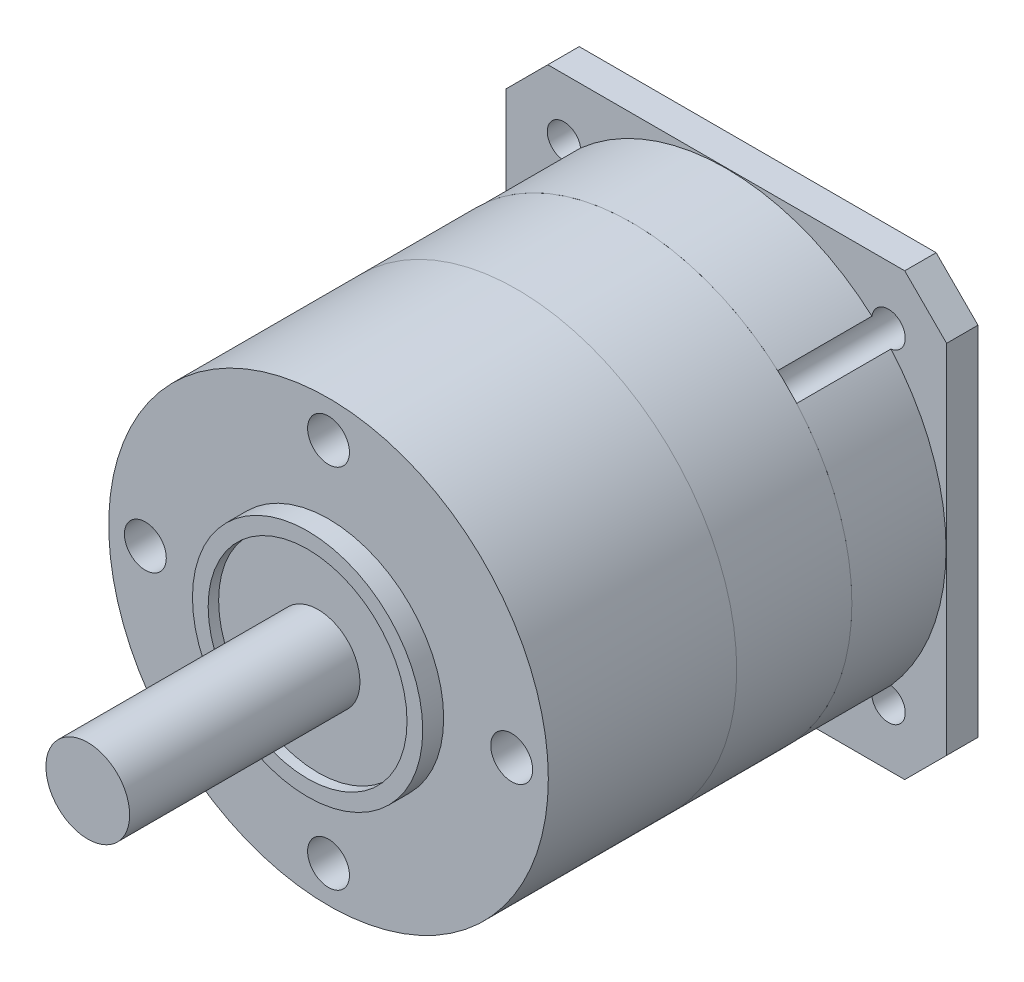
from build123d import *

# Parameters (mm, degrees)
SKETCH1_W           = 42.1
SKETCH1_H           = 42.1
BOSS_EXTRUDE2_DEPTH = 3
SKETCH3_R           = 21
BOSS_EXTRUDE3_DEPTH = 9
SKETCH4_R           = 21
BOSS_EXTRUDE4_DEPTH = 11
SKETCH5_R           = 21
BOSS_EXTRUDE5_DEPTH = 18
SKETCH6_R           = 11
BOSS_EXTRUDE6_DEPTH = 2
SKETCH9_R           = 9.5
CUT_EXTRUDE2_DEPTH  = 1
SKETCH7_R           = 4
BOSS_EXTRUDE7_DEPTH = 23
CUT_EXTRUDE3_START  = -12
SKETCH10_R          = 1.6
CUT_EXTRUDE3_DEPTH  = 12
SKETCH12_R          = 2
CUT_EXTRUDE5_DEPTH  = 10
CHAMFER1_SIZE       = 4
SKETCH15_R          = 11
CUT_EXTRUDE8_DEPTH  = 1.5


with BuildPart() as part:
    # Sketch1 → Boss-Extrude2 (new body)
    with BuildSketch(Plane.XY):
        Rectangle(SKETCH1_W, SKETCH1_H)
    extrude(amount=BOSS_EXTRUDE2_DEPTH)

    # Sketch3 → Boss-Extrude3 (add)
    with BuildSketch(Plane.XY.offset(3)):
        Circle(SKETCH3_R)
    extrude(amount=BOSS_EXTRUDE3_DEPTH)

    # Sketch10 → Cut-Extrude3 (cut)
    with BuildSketch(Plane(origin=(0, 0, 0), x_dir=(-1, 0, 0), z_dir=(0, 0, -1)).offset(CUT_EXTRUDE3_START)):
        with Locations((-15.5, 15.5)):
            Circle(SKETCH10_R)
        with Locations((15.5, 15.5)):
            Circle(SKETCH10_R)
        with Locations((15.5, -15.5)):
            Circle(SKETCH10_R)
        with Locations((-15.5, -15.5)):
            Circle(SKETCH10_R)
    extrude(amount=CUT_EXTRUDE3_DEPTH, mode=Mode.SUBTRACT)

    # Chamfer1
    chamfer1_edges = [part.edges().sort_by_distance(p)[0] for p in [
        (-21.05, 21.05, 1.5),
        (21.05, 21.05, 1.5),
        (21.05, -21.05, 1.5),
        (-21.05, -21.05, 1.5),
    ]]
    chamfer(chamfer1_edges, length=CHAMFER1_SIZE)

    # Sketch15 → Cut-Extrude8 (cut)
    with BuildSketch(Plane(origin=(0, 0, 0), x_dir=(-1, 0, 0), z_dir=(0, 0, -1))):
        with Locations(Location((0, 0, 0), (0, 0, 180))):
            Circle(SKETCH15_R)
    extrude(amount=-CUT_EXTRUDE8_DEPTH, mode=Mode.SUBTRACT)


with BuildPart() as body_2:
    # Sketch4 → Boss-Extrude4 (new body)
    with BuildSketch(Plane.XY.offset(12)):
        Circle(SKETCH4_R)
    extrude(amount=BOSS_EXTRUDE4_DEPTH)


with BuildPart() as body_3:
    # Sketch5 → Boss-Extrude5 (new body)
    with BuildSketch(Plane.XY.offset(23)):
        Circle(SKETCH5_R)
    extrude(amount=BOSS_EXTRUDE5_DEPTH)

    # Sketch6 → Boss-Extrude6 (add)
    with BuildSketch(Plane.XY.offset(41)):
        Circle(SKETCH6_R)
    extrude(amount=BOSS_EXTRUDE6_DEPTH)

    # Sketch9 → Cut-Extrude2 (cut)
    with BuildSketch(Plane.XY.offset(43)):
        Circle(SKETCH9_R)
    extrude(amount=-CUT_EXTRUDE2_DEPTH, mode=Mode.SUBTRACT)

    # Sketch12 → Cut-Extrude5 (cut)
    with BuildSketch(Plane.XY.offset(41)):
        with Locations((0, 17.5)):
            Circle(SKETCH12_R)
        with Locations((17.5, 0)):
            Circle(SKETCH12_R)
        with Locations((0, -17.5)):
            Circle(SKETCH12_R)
        with Locations((-17.5, 0)):
            Circle(SKETCH12_R)
    extrude(amount=-CUT_EXTRUDE5_DEPTH, mode=Mode.SUBTRACT)


with BuildPart() as body_4:
    # Sketch7 → Boss-Extrude7 (new body)
    with BuildSketch(Plane.XY.offset(41)):
        Circle(SKETCH7_R)
    extrude(amount=BOSS_EXTRUDE7_DEPTH)


solid = Compound([part.part, body_2.part, body_3.part, body_4.part])
